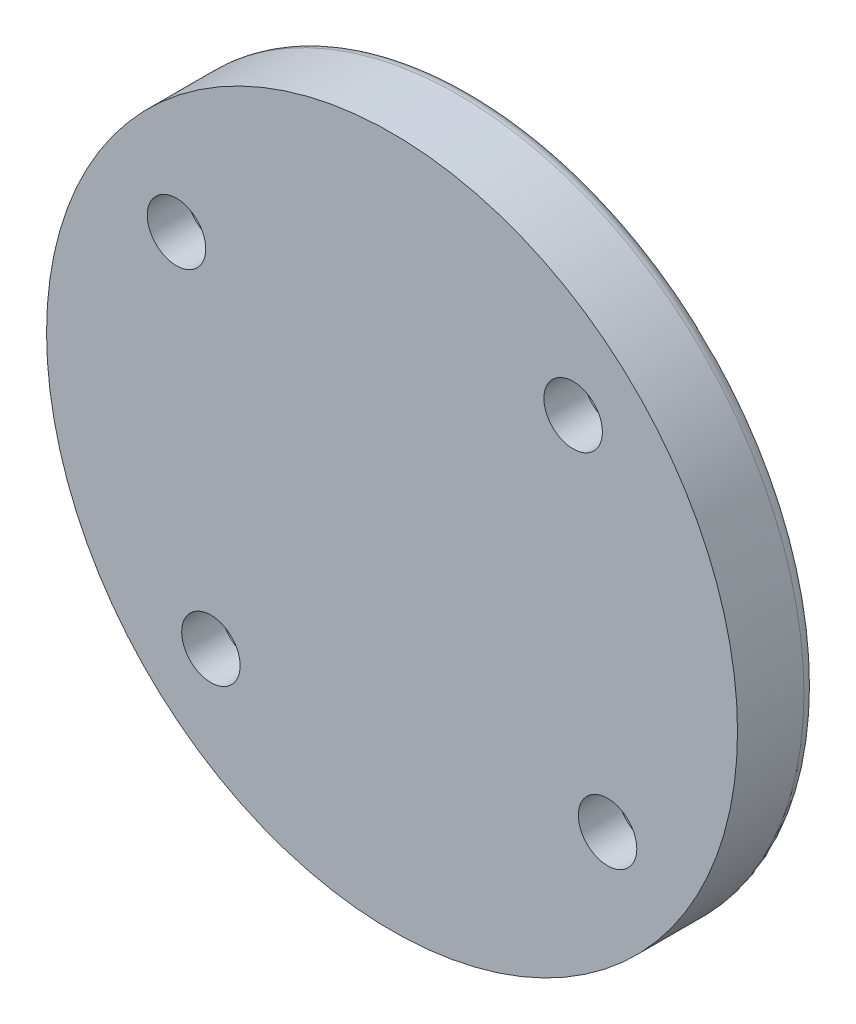
from build123d import *

# Parameters (mm, degrees)
SKETCH_1_R          = 13
SKETCH_1_R_2        = 1.1
EXTRUDE_1_DEPTH     = 3
FILLET_1_R          = 0.5
SKETCH_2_R          = 2.35
CUT_EXTRUDE_1_DEPTH = 1.5


with BuildPart() as part:
    # 草图1 → 凸台-拉伸1 (new body)
    with BuildSketch(Plane.XY):
        with Locations((66.770274295, -357.783074412)):
            Circle(SKETCH_1_R)
        with Locations((59.955130925, -364.997907801)):
            Circle(SKETCH_1_R_2, mode=Mode.SUBTRACT)
        with Locations((74.880510465, -363.503569956)):
            Circle(SKETCH_1_R_2, mode=Mode.SUBTRACT)
        with Locations((58.660038126, -352.062578867)):
            Circle(SKETCH_1_R_2, mode=Mode.SUBTRACT)
        with Locations((73.585417665, -350.568241022)):
            Circle(SKETCH_1_R_2, mode=Mode.SUBTRACT)
    extrude(amount=EXTRUDE_1_DEPTH)

    # 圆角1
    fillet_1_edges = [part.edges().sort_by_distance(p)[0] for p in [
        (53.770274295, -357.783074412, 0),
    ]]
    fillet(fillet_1_edges, radius=FILLET_1_R)

    # 草图2 → 切除-拉伸1 (cut)
    with BuildSketch(Plane(origin=(0, 0, 0), x_dir=(-1, 0, 0), z_dir=(0, 0, -1))):
        with Locations((-73.585417665, -350.568241022)):
            Circle(SKETCH_2_R)
        with Locations((-58.660038126, -352.062578867)):
            Circle(SKETCH_2_R)
        with Locations((-59.955130925, -364.997907801)):
            Circle(SKETCH_2_R)
        with Locations((-74.880510465, -363.503569956)):
            Circle(SKETCH_2_R)
    extrude(amount=-CUT_EXTRUDE_1_DEPTH, mode=Mode.SUBTRACT)


solid = part.part
